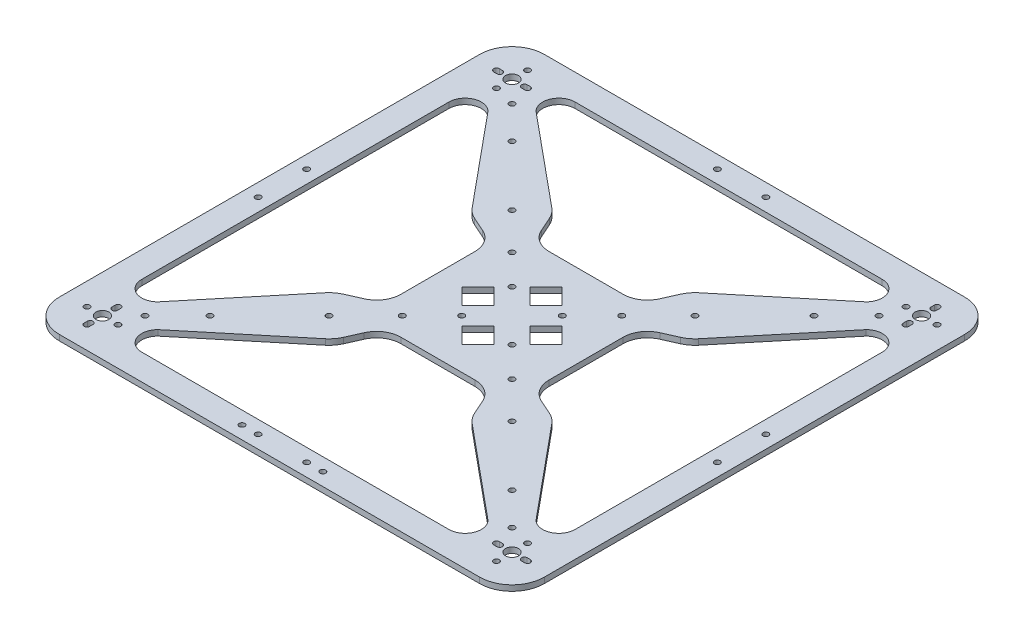
from build123d import *

# Parameters (mm, degrees)
SKETCH_1_R      = 1.75
SKETCH_1_R_2    = 4
EXTRUDE_1_DEPTH = 3.5


with BuildPart() as part:
    # 草图1 → 凸台-拉伸1 (new body)
    with BuildSketch(Plane(origin=(0, 0, 0), x_dir=(1, 0, 0), z_dir=(0, 1, 0))):
        with BuildLine():
            Line((130, 150), (-130, 150))
            ThreePointArc((-130, 150), (-144.142135624, 144.142135624), (-150, 130))
            Line((-150, 130), (-150, -130))
            ThreePointArc((-150, -130), (-144.142135624, -144.142135624), (-130, -150))
            Line((-130, -150), (130, -150))
            ThreePointArc((130, -150), (144.142135624, -144.142135624), (150, -130))
            Line((150, -130), (150, 130))
            ThreePointArc((150, 130), (144.142135624, 144.142135624), (130, 150))
        make_face()
        with BuildLine():
            ThreePointArc((-124.915476221, -136.290476221), (-126.665476221, -138.040476221), (-128.415476221, -136.290476221))
            Line((-128.415476221, -136.290476221), (-128.415476221, -134.290476221))
            ThreePointArc((-128.415476221, -134.290476221), (-126.665476221, -132.540476221), (-124.915476221, -134.290476221))
            Line((-124.915476221, -134.290476221), (-124.915476221, -136.290476221))
        make_face(mode=Mode.SUBTRACT)
        with Locations(Location((-136.290476221, -126.665476221, 0), (0, 0, 270))):
            Circle(SKETCH_1_R, mode=Mode.SUBTRACT)
        with Locations(Location((-126.665476221, -126.665476221, 0), (0, 0, 270))):
            Circle(SKETCH_1_R_2, mode=Mode.SUBTRACT)
        with Locations(Location((-117.040476221, -126.665476221, 0), (0, 0, 270))):
            Circle(SKETCH_1_R, mode=Mode.SUBTRACT)
        with BuildLine():
            Line((-128.415476221, -119.040476221), (-128.415476221, -117.040476221))
            ThreePointArc((-128.415476221, -117.040476221), (-126.665476221, -115.290476221), (-124.915476221, -117.040476221))
            Line((-124.915476221, -117.040476221), (-124.915476221, -119.040476221))
            ThreePointArc((-124.915476221, -119.040476221), (-126.665476221, -120.790476221), (-128.415476221, -119.040476221))
        make_face(mode=Mode.SUBTRACT)
        with Locations(Location((-113.5, -113.5, 0), (0, 0, 270))):
            Circle(SKETCH_1_R, mode=Mode.SUBTRACT)
        with Locations(Location((-93.431457505, -93.431457505, 0), (0, 0, 270))):
            Circle(SKETCH_1_R, mode=Mode.SUBTRACT)
        with Locations(Location((-25, -142, 0), (0, 0, 270))):
            Circle(SKETCH_1_R, mode=Mode.SUBTRACT)
        with Locations(Location((-15, -142, 0), (0, 0, 270))):
            Circle(SKETCH_1_R, mode=Mode.SUBTRACT)
        with Locations(Location((-142, -15, 0), (0, 0, 270))):
            Circle(SKETCH_1_R, mode=Mode.SUBTRACT)
        with BuildLine():
            Line((-134, -95), (-134, 95))
            ThreePointArc((-134, 95), (-127.826834324, 104.238795325), (-116.928932188, 102.071067812))
            Line((-116.928932188, 102.071067812), (-70.051905561, 45.412874858))
            ThreePointArc((-70.051905561, 45.412874858), (-67.142690979, 42.624461893), (-63.672786658, 40.575427887))
            Line((-63.672786658, 40.575427887), (-54.768512236, 36.620092035))
            ThreePointArc((-54.768512236, 36.620092035), (-48.28129326, 31.086661232), (-45.857864376, 22.911708085))
            Line((-45.857864376, 22.911708085), (-45.857864376, -22.911708085))
            ThreePointArc((-45.857864376, -22.911708085), (-48.28129326, -31.086661232), (-54.768512236, -36.620092035))
            Line((-54.768512236, -36.620092035), (-63.672786658, -40.575427887))
            ThreePointArc((-63.672786658, -40.575427887), (-67.142690979, -42.624461893), (-70.051905561, -45.412874858))
            Line((-70.051905561, -45.412874858), (-116.928932188, -102.071067812))
            ThreePointArc((-116.928932188, -102.071067812), (-127.826834324, -104.238795325), (-134, -95))
        make_face(mode=Mode.SUBTRACT)
        with Locations(Location((-56.568542495, -56.568542495, 0), (0, 0, 270))):
            Circle(SKETCH_1_R, mode=Mode.SUBTRACT)
        with Locations(Location((-33.941125497, -33.941125497, 0), (0, 0, 270))):
            Circle(SKETCH_1_R, mode=Mode.SUBTRACT)
        Polygon((-20.899494937, 9.899494937), (-11, 0), (-20.899494937, -9.899494937), (-30.798989873, 0), align=None, mode=Mode.SUBTRACT)
        with Locations(Location((-15.556349186, -15.556349186, 0), (0, 0, 270))):
            Circle(SKETCH_1_R, mode=Mode.SUBTRACT)
        with Locations(Location((15, -142, 0), (0, 0, 270))):
            Circle(SKETCH_1_R, mode=Mode.SUBTRACT)
        with Locations(Location((25, -142, 0), (0, 0, 270))):
            Circle(SKETCH_1_R, mode=Mode.SUBTRACT)
        with BuildLine():
            ThreePointArc((102.071067812, -116.928932188), (104.238795325, -127.826834324), (95, -134))
            Line((95, -134), (-95, -134))
            ThreePointArc((-95, -134), (-104.238795325, -127.826834324), (-102.071067812, -116.928932188))
            Line((-102.071067812, -116.928932188), (-45.412874858, -70.051905561))
            ThreePointArc((-45.412874858, -70.051905561), (-42.624461893, -67.142690979), (-40.575427887, -63.672786658))
            Line((-40.575427887, -63.672786658), (-36.620092035, -54.768512236))
            ThreePointArc((-36.620092035, -54.768512236), (-31.086661232, -48.28129326), (-22.911708085, -45.857864376))
            Line((-22.911708085, -45.857864376), (22.911708085, -45.857864376))
            ThreePointArc((22.911708085, -45.857864376), (31.086661232, -48.28129326), (36.620092035, -54.768512236))
            Line((36.620092035, -54.768512236), (40.575427887, -63.672786658))
            ThreePointArc((40.575427887, -63.672786658), (42.624461893, -67.142690979), (45.412874858, -70.051905561))
            Line((45.412874858, -70.051905561), (102.071067812, -116.928932188))
        make_face(mode=Mode.SUBTRACT)
        with BuildLine():
            ThreePointArc((124.915476221, -136.290476221), (126.665476221, -134.540476221), (128.415476221, -136.290476221))
            ThreePointArc((128.415476221, -136.290476221), (126.665476221, -138.040476221), (124.915476221, -136.290476221))
        make_face(mode=Mode.SUBTRACT)
        with BuildLine():
            Line((119.040476221, -128.415476221), (117.040476221, -128.415476221))
            ThreePointArc((117.040476221, -128.415476221), (115.290476221, -126.665476221), (117.040476221, -124.915476221))
            Line((117.040476221, -124.915476221), (119.040476221, -124.915476221))
            ThreePointArc((119.040476221, -124.915476221), (120.790476221, -126.665476221), (119.040476221, -128.415476221))
        make_face(mode=Mode.SUBTRACT)
        with Locations(Location((126.665476221, -126.665476221, 0), (0, 0, 270))):
            Circle(SKETCH_1_R_2, mode=Mode.SUBTRACT)
        with Locations(Location((113.5, -113.5, 0), (0, 0, 270))):
            Circle(SKETCH_1_R, mode=Mode.SUBTRACT)
        with BuildLine():
            ThreePointArc((124.915476221, -117.040476221), (126.665476221, -115.290476221), (128.415476221, -117.040476221))
            ThreePointArc((128.415476221, -117.040476221), (126.665476221, -118.790476221), (124.915476221, -117.040476221))
        make_face(mode=Mode.SUBTRACT)
        with BuildLine():
            Line((134.290476221, -124.915476221), (136.290476221, -124.915476221))
            ThreePointArc((136.290476221, -124.915476221), (138.040476221, -126.665476221), (136.290476221, -128.415476221))
            Line((136.290476221, -128.415476221), (134.290476221, -128.415476221))
            ThreePointArc((134.290476221, -128.415476221), (132.540476221, -126.665476221), (134.290476221, -124.915476221))
        make_face(mode=Mode.SUBTRACT)
        with Locations(Location((93.431457505, -93.431457505, 0), (0, 0, 270))):
            Circle(SKETCH_1_R, mode=Mode.SUBTRACT)
        with Locations(Location((56.568542495, -56.568542495, 0), (0, 0, 270))):
            Circle(SKETCH_1_R, mode=Mode.SUBTRACT)
        Polygon((-9.899494937, -20.899494937), (0, -11), (9.899494937, -20.899494937), (0, -30.798989873), align=None, mode=Mode.SUBTRACT)
        with Locations(Location((33.941125497, -33.941125497, 0), (0, 0, 270))):
            Circle(SKETCH_1_R, mode=Mode.SUBTRACT)
        with Locations(Location((15.556349186, -15.556349186, 0), (0, 0, 270))):
            Circle(SKETCH_1_R, mode=Mode.SUBTRACT)
        with Locations(Location((142, -15, 0), (0, 0, 270))):
            Circle(SKETCH_1_R, mode=Mode.SUBTRACT)
        with Locations(Location((-142, 15, 0), (0, 0, 270))):
            Circle(SKETCH_1_R, mode=Mode.SUBTRACT)
        with Locations(Location((-15.556349186, 15.556349186, 0), (0, 0, 270))):
            Circle(SKETCH_1_R, mode=Mode.SUBTRACT)
        with Locations(Location((-33.941125497, 33.941125497, 0), (0, 0, 270))):
            Circle(SKETCH_1_R, mode=Mode.SUBTRACT)
        with Locations(Location((-56.568542495, 56.568542495, 0), (0, 0, 270))):
            Circle(SKETCH_1_R, mode=Mode.SUBTRACT)
        with Locations(Location((-93.431457505, 93.431457505, 0), (0, 0, 270))):
            Circle(SKETCH_1_R, mode=Mode.SUBTRACT)
        with BuildLine():
            ThreePointArc((-136.290476221, 124.915476221), (-138.040476221, 126.665476221), (-136.290476221, 128.415476221))
            Line((-136.290476221, 128.415476221), (-134.290476221, 128.415476221))
            ThreePointArc((-134.290476221, 128.415476221), (-132.540476221, 126.665476221), (-134.290476221, 124.915476221))
            Line((-134.290476221, 124.915476221), (-136.290476221, 124.915476221))
        make_face(mode=Mode.SUBTRACT)
        with BuildLine():
            ThreePointArc((-124.915476221, 117.040476221), (-126.665476221, 115.290476221), (-128.415476221, 117.040476221))
            ThreePointArc((-128.415476221, 117.040476221), (-126.665476221, 118.790476221), (-124.915476221, 117.040476221))
        make_face(mode=Mode.SUBTRACT)
        with Locations(Location((-113.5, 113.5, 0), (0, 0, 270))):
            Circle(SKETCH_1_R, mode=Mode.SUBTRACT)
        with Locations(Location((-126.665476221, 126.665476221, 0), (0, 0, 270))):
            Circle(SKETCH_1_R_2, mode=Mode.SUBTRACT)
        with BuildLine():
            ThreePointArc((-117.040476221, 128.415476221), (-115.290476221, 126.665476221), (-117.040476221, 124.915476221))
            Line((-117.040476221, 124.915476221), (-119.040476221, 124.915476221))
            ThreePointArc((-119.040476221, 124.915476221), (-120.790476221, 126.665476221), (-119.040476221, 128.415476221))
            Line((-119.040476221, 128.415476221), (-117.040476221, 128.415476221))
        make_face(mode=Mode.SUBTRACT)
        with BuildLine():
            ThreePointArc((-124.915476221, 136.290476221), (-126.665476221, 134.540476221), (-128.415476221, 136.290476221))
            ThreePointArc((-128.415476221, 136.290476221), (-126.665476221, 138.040476221), (-124.915476221, 136.290476221))
        make_face(mode=Mode.SUBTRACT)
        with Locations(Location((-15, 142, 0), (0, 0, 270))):
            Circle(SKETCH_1_R, mode=Mode.SUBTRACT)
        with Locations(Location((15.556349186, 15.556349186, 0), (0, 0, 270))):
            Circle(SKETCH_1_R, mode=Mode.SUBTRACT)
        Polygon((20.899494937, -9.899494937), (11, 0), (20.899494937, 9.899494937), (30.798989873, 0), align=None, mode=Mode.SUBTRACT)
        Polygon((-9.899494937, 20.899494937), (0, 30.798989873), (9.899494937, 20.899494937), (0, 11), align=None, mode=Mode.SUBTRACT)
        with Locations(Location((33.941125497, 33.941125497, 0), (0, 0, 270))):
            Circle(SKETCH_1_R, mode=Mode.SUBTRACT)
        with Locations(Location((56.568542495, 56.568542495, 0), (0, 0, 270))):
            Circle(SKETCH_1_R, mode=Mode.SUBTRACT)
        with BuildLine():
            Line((134, 95), (134, -95))
            ThreePointArc((134, -95), (127.826834324, -104.238795325), (116.928932188, -102.071067812))
            Line((116.928932188, -102.071067812), (70.051905561, -45.412874858))
            ThreePointArc((70.051905561, -45.412874858), (67.142690979, -42.624461893), (63.672786658, -40.575427887))
            Line((63.672786658, -40.575427887), (54.768512236, -36.620092035))
            ThreePointArc((54.768512236, -36.620092035), (48.28129326, -31.086661232), (45.857864376, -22.911708085))
            Line((45.857864376, -22.911708085), (45.857864376, 22.911708085))
            ThreePointArc((45.857864376, 22.911708085), (48.28129326, 31.086661232), (54.768512236, 36.620092035))
            Line((54.768512236, 36.620092035), (63.672786658, 40.575427887))
            ThreePointArc((63.672786658, 40.575427887), (67.142690979, 42.624461893), (70.051905561, 45.412874858))
            Line((70.051905561, 45.412874858), (116.928932188, 102.071067812))
            ThreePointArc((116.928932188, 102.071067812), (127.826834324, 104.238795325), (134, 95))
        make_face(mode=Mode.SUBTRACT)
        with Locations(Location((142, 15, 0), (0, 0, 270))):
            Circle(SKETCH_1_R, mode=Mode.SUBTRACT)
        with BuildLine():
            ThreePointArc((-102.071067812, 116.928932188), (-104.238795325, 127.826834324), (-95, 134))
            Line((-95, 134), (95, 134))
            ThreePointArc((95, 134), (104.238795325, 127.826834324), (102.071067812, 116.928932188))
            Line((102.071067812, 116.928932188), (45.412874858, 70.051905561))
            ThreePointArc((45.412874858, 70.051905561), (42.624461893, 67.142690979), (40.575427887, 63.672786658))
            Line((40.575427887, 63.672786658), (36.620092035, 54.768512236))
            ThreePointArc((36.620092035, 54.768512236), (31.086661232, 48.28129326), (22.911708085, 45.857864376))
            Line((22.911708085, 45.857864376), (-22.911708085, 45.857864376))
            ThreePointArc((-22.911708085, 45.857864376), (-31.086661232, 48.28129326), (-36.620092035, 54.768512236))
            Line((-36.620092035, 54.768512236), (-40.575427887, 63.672786658))
            ThreePointArc((-40.575427887, 63.672786658), (-42.624461893, 67.142690979), (-45.412874858, 70.051905561))
            Line((-45.412874858, 70.051905561), (-102.071067812, 116.928932188))
        make_face(mode=Mode.SUBTRACT)
        with Locations(Location((15, 142, 0), (0, 0, 270))):
            Circle(SKETCH_1_R, mode=Mode.SUBTRACT)
        with Locations(Location((93.431457505, 93.431457505, 0), (0, 0, 270))):
            Circle(SKETCH_1_R, mode=Mode.SUBTRACT)
        with Locations(Location((113.5, 113.5, 0), (0, 0, 270))):
            Circle(SKETCH_1_R, mode=Mode.SUBTRACT)
        with BuildLine():
            Line((128.415476221, 119.040476221), (128.415476221, 117.040476221))
            ThreePointArc((128.415476221, 117.040476221), (126.665476221, 115.290476221), (124.915476221, 117.040476221))
            Line((124.915476221, 117.040476221), (124.915476221, 119.040476221))
            ThreePointArc((124.915476221, 119.040476221), (126.665476221, 120.790476221), (128.415476221, 119.040476221))
        make_face(mode=Mode.SUBTRACT)
        with Locations(Location((117.040476221, 126.665476221, 0), (0, 0, 270))):
            Circle(SKETCH_1_R, mode=Mode.SUBTRACT)
        with Locations(Location((126.665476221, 126.665476221, 0), (0, 0, 270))):
            Circle(SKETCH_1_R_2, mode=Mode.SUBTRACT)
        with Locations(Location((136.290476221, 126.665476221, 0), (0, 0, 270))):
            Circle(SKETCH_1_R, mode=Mode.SUBTRACT)
        with BuildLine():
            ThreePointArc((124.915476221, 136.290476221), (126.665476221, 138.040476221), (128.415476221, 136.290476221))
            Line((128.415476221, 136.290476221), (128.415476221, 134.290476221))
            ThreePointArc((128.415476221, 134.290476221), (126.665476221, 132.540476221), (124.915476221, 134.290476221))
            Line((124.915476221, 134.290476221), (124.915476221, 136.290476221))
        make_face(mode=Mode.SUBTRACT)
    extrude(amount=EXTRUDE_1_DEPTH)


solid = part.part
